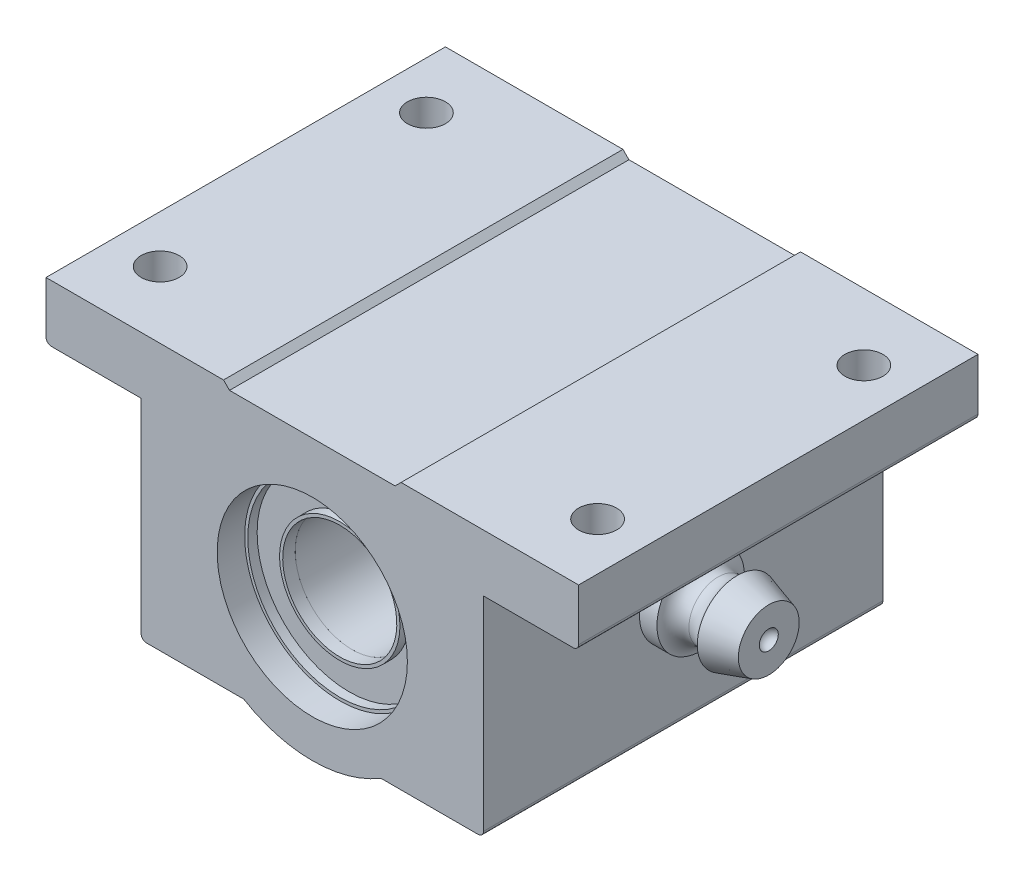
from build123d import *

# Parameters (mm, degrees)
SKETCH1_R            = 7.9375
MAIN_BODY_DEPTH      = 16.66875
INTERIOR_DEPTH       = 13.335
INTERIOR_DEPTH_BACK  = 13.335
SKETCH8_R            = 7.9375
SKETCH8_R_2          = 4.7625
FILLETS_R            = 0.446484375
SKETCH3_R            = 1.5875
MOUNTING_HOLES_DEPTH = 4.7625


with BuildPart() as part:
    # Sketch1 → Main Body (new, symmetric)
    with BuildSketch(Plane.XY):
        with BuildLine():
            Line((-14.2875, 7.9375), (-22.225, 7.9375))
            Line((-22.225, 7.9375), (-22.225, 12.7))
            Line((-22.225, 12.7), (-7.408333333, 12.7))
            Line((-7.408333333, 12.7), (-6.907017544, 12.198684211))
            Line((-6.907017544, 12.198684211), (6.907017544, 12.198684211))
            Line((6.907017544, 12.198684211), (7.408333333, 12.7))
            Line((7.408333333, 12.7), (22.225, 12.7))
            Line((22.225, 12.7), (22.225, 7.9375))
            Line((22.225, 7.9375), (14.2875, 7.9375))
            Line((14.2875, 7.9375), (14.2875, -9.525))
            Line((14.2875, -9.525), (5.72381265, -9.525))
            ThreePointArc((5.72381265, -9.525), (0, -11.1125), (-5.72381265, -9.525))
            Line((-5.72381265, -9.525), (-14.2875, -9.525))
            Line((-14.2875, -9.525), (-14.2875, 7.9375))
        make_face()
        Circle(SKETCH1_R, mode=Mode.SUBTRACT)
    extrude(amount=MAIN_BODY_DEPTH, both=True)

    # Fillets
    fillets_edges = [part.edges().sort_by_distance(p)[0] for p in [
        (14.2875, -9.525, 0),
        (-14.2875, -9.525, 0),
        (-22.225, 7.9375, 0),
        (22.225, 7.9375, 0),
    ]]
    fillet(fillets_edges, radius=FILLETS_R)

    # Sketch3 → Mounting Holes (cut)
    with BuildSketch(Plane(origin=(0, 12.7, 0), x_dir=(1, 0, 0), z_dir=(0, 1, 0))):
        with Locations(Location((-18.25625, 11.1125, 0), (0, 0, 270))):
            Circle(SKETCH3_R)
        with Locations(Location((18.25625, 11.1125, 0), (0, 0, 270))):
            Circle(SKETCH3_R)
        with Locations(Location((18.25625, -11.1125, 0), (0, 0, 270))):
            Circle(SKETCH3_R)
        with Locations(Location((-18.25625, -11.1125, 0), (0, 0, 270))):
            Circle(SKETCH3_R)
    extrude(amount=-MOUNTING_HOLES_DEPTH, mode=Mode.SUBTRACT)


with BuildPart() as body_2:
    # Sketch8 → Interior (new, two sides: drawn at the far end of the back side and taken through both)
    with BuildSketch(Plane.XY.offset(-INTERIOR_DEPTH_BACK)):
        Circle(SKETCH8_R)
        Circle(SKETCH8_R_2, mode=Mode.SUBTRACT)
    extrude(amount=INTERIOR_DEPTH + INTERIOR_DEPTH_BACK)


with BuildPart() as body_3:
    # Seal 2 → Seal (revolve)
    with BuildSketch(Plane(origin=(0, 0, 0), x_dir=(0, 0, -1), z_dir=(1, 0, 0))):
        Polygon((-13.335, 4.7625), (-14.376796875, 4.7625), (-14.376796875, 5.022949219), (-13.595449219, 5.022949219), (-13.595449219, 7.677050781), (-14.376796875, 7.677050781), (-14.376796875, 7.9375), (-13.335, 7.9375), align=None)
    revolve(axis=Axis((0, 0, 0), (0, 0, 1)))


with BuildPart() as body_4:
    # Grease Fitting 2 → Grease Fitting (revolve)
    with BuildSketch(Plane.XY):
        with BuildLine():
            Line((14.2875, 0), (14.2875, 3.65125))
            Line((14.2875, 3.65125), (15.748, 3.65125))
            ThreePointArc((15.748, 3.65125), (16.261306448, 2.785384121), (17.2085, 2.44475))
            ThreePointArc((17.2085, 2.44475), (18.118235848, 2.682132415), (18.796, 3.33375))
            Line((18.796, 3.33375), (21.43125, 2.54))
            Line((21.43125, 2.54), (21.43125, 0.79375))
            ThreePointArc((21.43125, 0.79375), (20.869983992, 0.561266008), (20.6375, 0))
            Line((20.6375, 0), (14.2875, 0))
        make_face()
    revolve(axis=Axis((20.6375, 0, 0), (-1, 0, 0)))


with BuildPart() as body_5:
    # Seal Mirror: mirrored copy
    add(body_3.part.mirror(Plane.XY))


solid = Compound([part.part, body_2.part, body_3.part, body_4.part, body_5.part])
